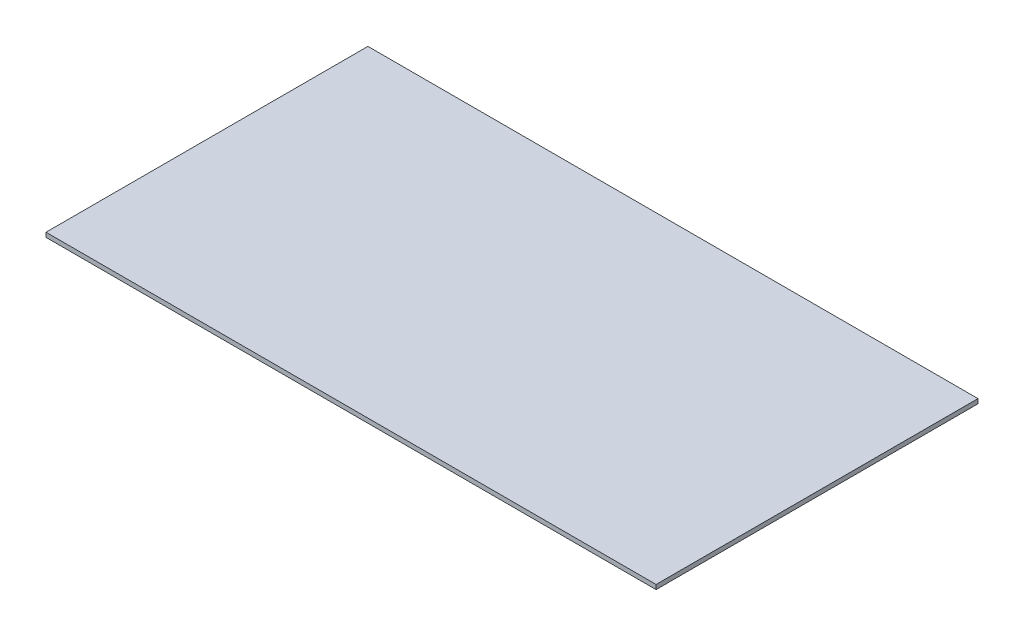
from build123d import *

# Parameters (mm, degrees)
SKETCH1_W           = 431.8
SKETCH1_H           = 227.838
BOSS_EXTRUDE1_DEPTH = 3.175


with BuildPart() as part:
    # Sketch1 → Boss-Extrude1 (new body)
    with BuildSketch(Plane(origin=(0, 0, 0), x_dir=(1, 0, 0), z_dir=(0, 1, 0))):
        with Locations((215.9, 113.919)):
            Rectangle(SKETCH1_W, SKETCH1_H)
    extrude(amount=BOSS_EXTRUDE1_DEPTH)


solid = part.part
